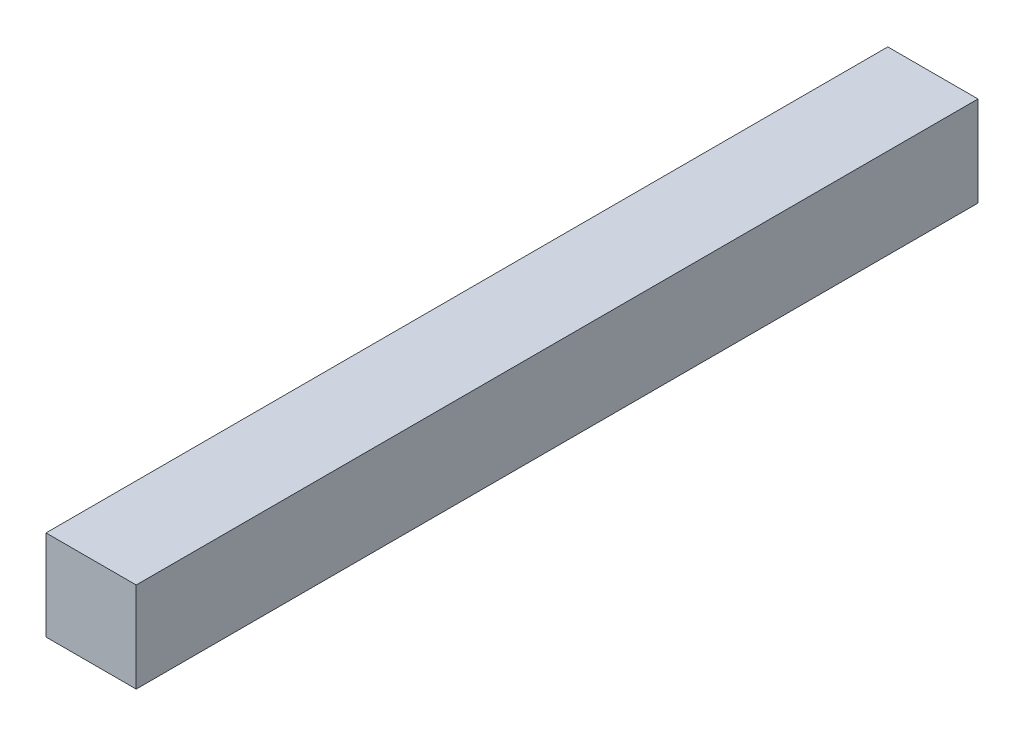
from build123d import *

# Parameters (mm, degrees)
BOSS_EXTRUDE1_DEPTH      = 11.1125
BOSS_EXTRUDE1_DEPTH_BACK = 11.1125
SKETCH3_W                = 2.38125
SKETCH3_H                = 2.38125


with BuildPart() as part:
    # Sketch3 → Boss-Extrude1 (new, two sides: drawn at the far end of the back side and taken through both)
    with BuildSketch(Plane.XY.offset(-BOSS_EXTRUDE1_DEPTH_BACK)):
        Rectangle(SKETCH3_W, SKETCH3_H)
    extrude(amount=BOSS_EXTRUDE1_DEPTH + BOSS_EXTRUDE1_DEPTH_BACK)


solid = part.part
